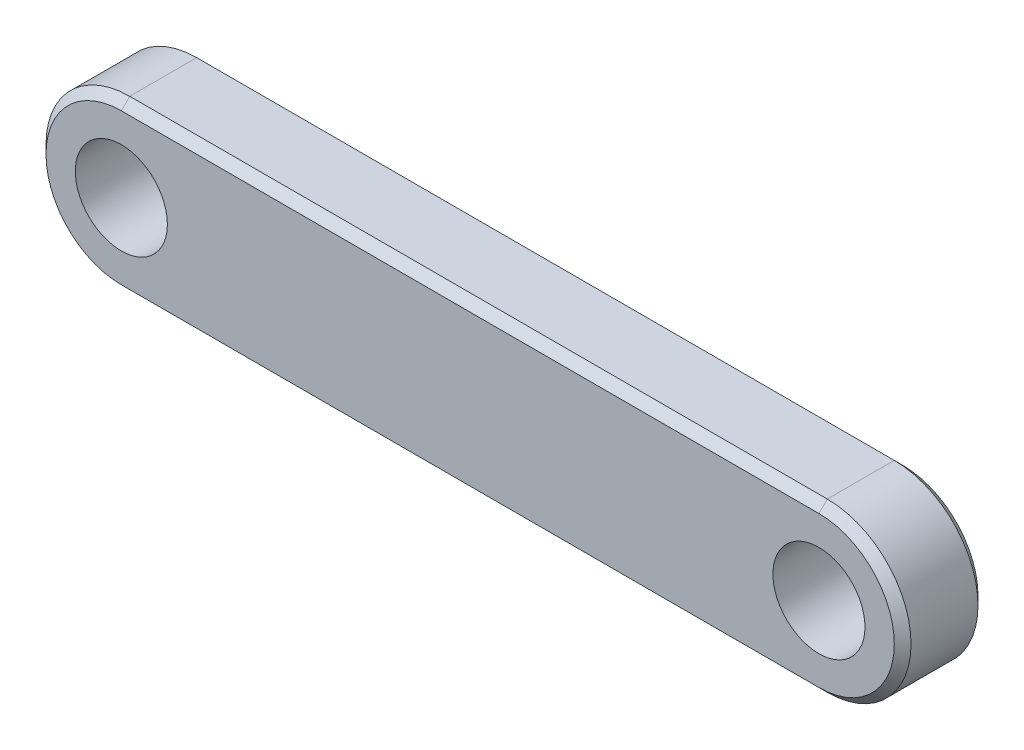
from build123d import *

# Parameters (mm, degrees)
SKETCH_1_R      = 1.65
EXTRUDE_1_DEPTH = 3
CHAMFER_1_SIZE  = 0.3


with BuildPart() as part:
    # 草图1 → 凸台-拉伸1 (new body)
    with BuildSketch(Plane.XY):
        with BuildLine():
            Line((-12.5, 3), (12.5, 3))
            ThreePointArc((12.5, 3), (15.5, 0), (12.5, -3))
            Line((12.5, -3), (-12.5, -3))
            ThreePointArc((-12.5, -3), (-15.5, 0), (-12.5, 3))
        make_face()
        with Locations((-12.5, 0)):
            Circle(SKETCH_1_R, mode=Mode.SUBTRACT)
        with Locations((12.5, 0)):
            Circle(SKETCH_1_R, mode=Mode.SUBTRACT)
    extrude(amount=EXTRUDE_1_DEPTH)

    # 倒角1
    chamfer_1_edges = [part.edges().sort_by_distance(p)[0] for p in [
        (-14.15, 0, 0),
        (15.5, 0, 3),
        (10.85, 0, 0),
        (0, 3, 3),
        (-15.5, 0, 3),
        (0, 3, 0),
        (15.5, 0, 0),
        (0, -3, 0),
        (-15.5, 0, 0),
        (0, -3, 3),
    ]]
    chamfer(chamfer_1_edges, length=CHAMFER_1_SIZE)


solid = part.part
